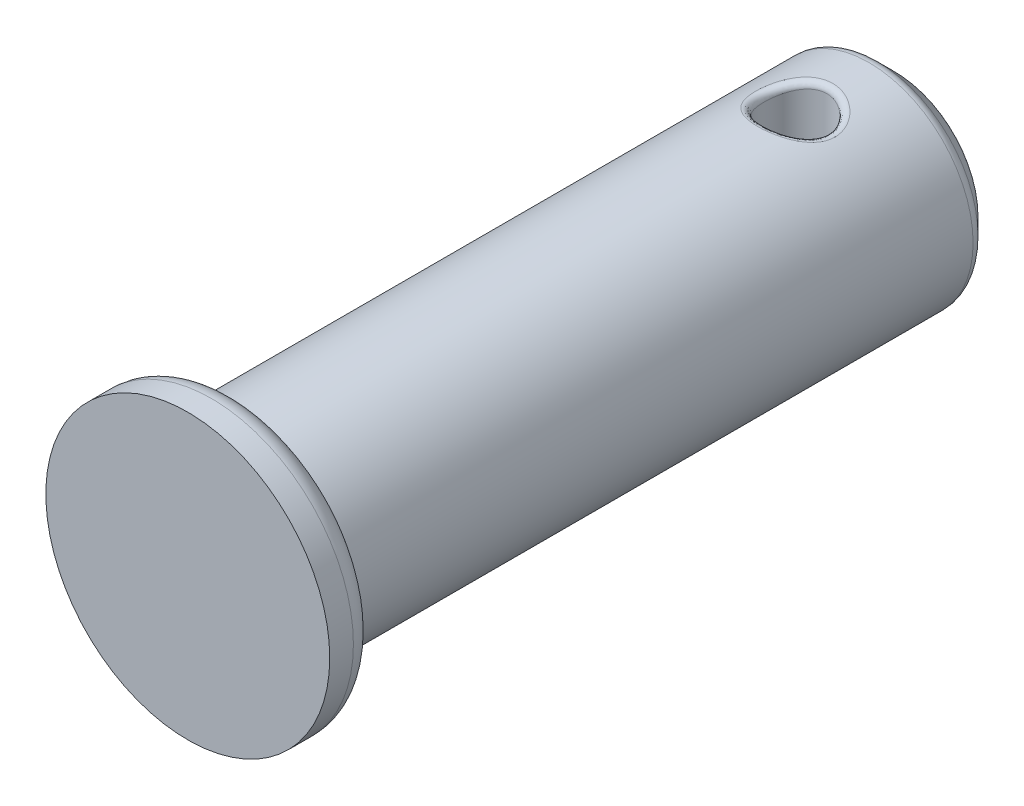
from build123d import *

# Parameters (mm, degrees)
SKETCH1_R               = 3.4925
BOSS_EXTRUDE1_DEPTH     = 22.225
SKETCH2_R               = 4.7625
BOSS_EXTRUDE2_DEPTH     = 1.5875
CUT_EXTRUDE1_DEPTH      = 25.746675913
CUT_EXTRUDE1_DEPTH_BACK = 25.746675913
SKETCH3_R               = 1.058333333
FILLET1_R               = 0.1984375
FILLET3_R               = 0.79375
CHAMFER1_SIZE           = 0.79375
FILLET4_R               = 0.396875


with BuildPart() as part:
    # Sketch1 → Boss-Extrude1 (new body)
    with BuildSketch(Plane.XY):
        Circle(SKETCH1_R)
    extrude(amount=BOSS_EXTRUDE1_DEPTH)

    # Sketch2 → Boss-Extrude2 (add)
    with BuildSketch(Plane.XY.offset(22.225)):
        Circle(SKETCH2_R)
    extrude(amount=BOSS_EXTRUDE2_DEPTH)

    # Sketch3 → Cut-Extrude1 (cut, two sides: drawn at the far end of the back side and taken through both)
    with BuildSketch(Plane(origin=(0, 0, 0), x_dir=(1, 0, 0), z_dir=(0, 1, 0)).offset(-CUT_EXTRUDE1_DEPTH_BACK)):
        with Locations(Location((0, -3.429, 0), (0, 0, 270))):
            Circle(SKETCH3_R)
    extrude(amount=CUT_EXTRUDE1_DEPTH + CUT_EXTRUDE1_DEPTH_BACK, mode=Mode.SUBTRACT)

    # Fillet1
    fillet1_edges = [part.edges().sort_by_distance(p)[0] for p in [
        (0, 3.492500015, 2.370666678),
        (0, -3.492500015, 2.370666678),
    ]]
    fillet(fillet1_edges, radius=FILLET1_R)

    # Fillet3
    fillet3_edges = [part.edges().sort_by_distance(p)[0] for p in [
        (-4.7625, 0, 22.225),
    ]]
    fillet(fillet3_edges, radius=FILLET3_R)

    # Chamfer1
    chamfer1_edges = [part.edges().sort_by_distance(p)[0] for p in [
        (-3.4925, 0, 0),
    ]]
    chamfer(chamfer1_edges, length=CHAMFER1_SIZE)

    # Fillet4
    fillet4_edges = [part.edges().sort_by_distance(p)[0] for p in [
        (-3.4925, 0, 0.79375),
        (-2.69875, 0, 0),
    ]]
    fillet(fillet4_edges, radius=FILLET4_R)


solid = part.part
